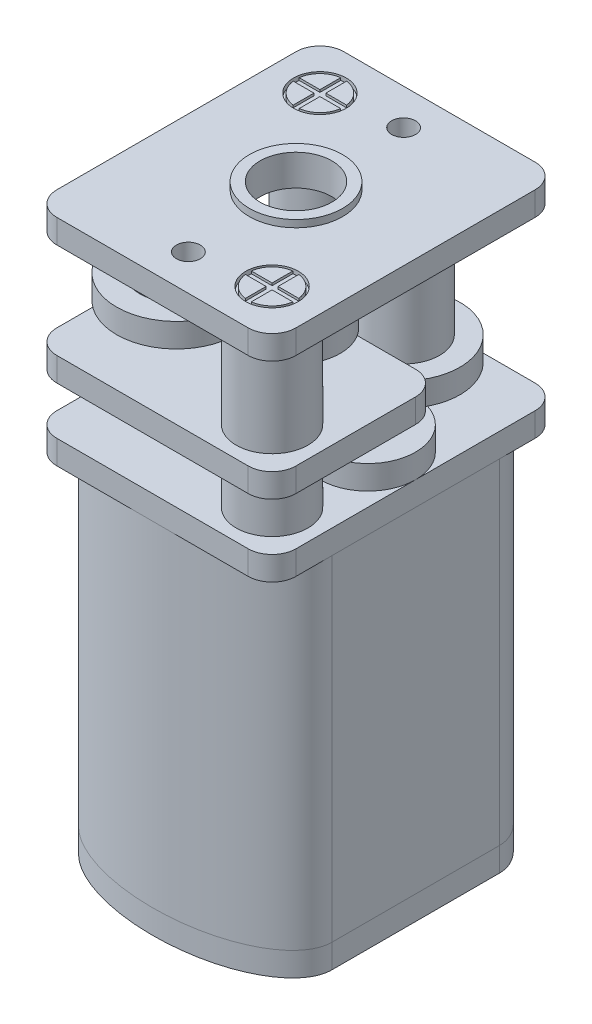
from build123d import *

# Parameters (mm, degrees)
SALIENTE_EXTRUIR1_DEPTH       = 1
CROQUIS2_R                    = 2.5
SALIENTE_EXTRUIR2_DEPTH       = 1
CROQUIS3_R                    = 1
CORTAR_EXTRUIR1_DEPTH         = 0.5
CROQUIS4_W                    = 1.5
CROQUIS4_H                    = 0.3
SALIENTE_EXTRUIR3_DEPTH       = 1.5
CROQUIS5_R                    = 0.5
CORTAR_EXTRUIR2_DEPTH         = 0.3
CORTAR_EXTRUIR3_START         = -0.3
CROQUIS6_R                    = 0.5
CORTAR_EXTRUIR3_DEPTH         = 0.3
SALIENTE_EXTRUIR4_DEPTH       = 14
CROQUIS8_W                    = 10
CROQUIS8_H                    = 12
SALIENTE_EXTRUIR5_DEPTH       = 1
CROQUIS23_R                   = 1
SALIENTE_EXTRUIR13_DEPTH      = 1
CROQUIS25_R                   = 2
SALIENTE_EXTRUIR18_DEPTH      = 1
CROQUIS26_R                   = 1
SALIENTE_EXTRUIR19_DEPTH      = 1
CROQUIS27_R                   = 2.354101966
SALIENTE_EXTRUIR21_DEPTH      = 1
CROQUIS29_R                   = 1.5
SALIENTE_EXTRUIR22_DEPTH      = 3
REDONDEO1_R                   = 1
REDONDEO2_R                   = 1
REDONDEO3_R                   = 1
REDONDEO4_R                   = 1
CROQUIS9_R                    = 1.5
SALIENTE_EXTRUIR6_DEPTH       = 2
CROQUIS10_W                   = 10
CROQUIS10_H                   = 12
SALIENTE_EXTRUIR7_DEPTH       = 1
CROQUIS11_R                   = 1.5
SALIENTE_EXTRUIR8_DEPTH       = 4
CROQUIS12_W                   = 5
CROQUIS12_H                   = 5
CORTAR_EXTRUIR4_DEPTH         = 1
CROQUIS30_R                   = 1.854101966
SALIENTE_EXTRUIR24_DEPTH      = 1
CROQUIS31_R                   = 1
SALIENTE_EXTRUIR26_DEPTH      = 1
CROQUIS32_R                   = 2.5
SALIENTE_EXTRUIR27_DEPTH      = 1
CROQUIS33_R                   = 1.535533906
SALIENTE_EXTRUIR28_DEPTH      = 2
SALIENTE_EXTRUIR29_DEPTH      = 2
SALIENTE_EXTRUIR29_DEPTH_BACK = 5
CROQUIS34_R                   = 0.2
CROQUIS35_R                   = 0.2
SALIENTE_EXTRUIR30_DEPTH      = 4
CROQUIS36_R                   = 0.2
SALIENTE_EXTRUIR31_DEPTH      = 2
REDONDEO5_R                   = 1
REDONDEO6_R                   = 1
REDONDEO7_R                   = 1
REDONDEO8_R                   = 1
REDONDEO9_R                   = 1
CROQUIS13_W                   = 10
CROQUIS13_H                   = 12
SALIENTE_EXTRUIR9_DEPTH       = 1
CROQUIS14_R                   = 1.95
CROQUIS14_R_2                 = 1.5
SALIENTE_EXTRUIR10_DEPTH      = 0.3
CROQUIS15_R                   = 0.5
CORTAR_EXTRUIR5_DEPTH         = 1
CROQUIS16_R                   = 1.1
CORTAR_EXTRUIR6_DEPTH         = 0.2
CROQUIS17_R                   = 1
SALIENTE_EXTRUIR11_DEPTH      = 0.2
CROQUIS18_R                   = 1
SALIENTE_EXTRUIR12_DEPTH      = 0.2
CORTAR_EXTRUIR7_DEPTH         = 0.1
CORTAR_EXTRUIR8_DEPTH         = 0.1
REDONDEO10_R                  = 1
REDONDEO11_R                  = 1
REDONDEO12_R                  = 1
REDONDEO13_R                  = 1
REDONDEO14_R                  = 1
CROQUIS22_R                   = 1.5
CORTAR_EXTRUIR9_DEPTH         = 1


with BuildPart() as part:
    # Croquis1 → Saliente-Extruir1 (new body)
    with BuildSketch(Plane(origin=(0, 0, 0), x_dir=(1, 0, 0), z_dir=(0, 1, 0))):
        with BuildLine():
            Line((5, 3.5), (5, -3.5))
            add(Edge.make_bspline(
                [(-5, -3.5), (-5, -6), (0, -6), (5, -6), (5, -3.5)],
                knots=[3.141592654, 3.141592654, 3.141592654, 4.71238898, 4.71238898, 6.283185307, 6.283185307, 6.283185307], degree=2, weights=[1, 0.707106781, 1, 0.707106781, 1]))
            Line((-5, -3.5), (-5, 3.5))
            add(Edge.make_bspline(
                [(5, 3.5), (5, 6), (0, 6), (-5, 6), (-5, 3.5)],
                knots=[3.141592654, 3.141592654, 3.141592654, 4.71238898, 4.71238898, 6.283185307, 6.283185307, 6.283185307], degree=2, weights=[1, 0.707106781, 1, 0.707106781, 1]))
        make_face()
    extrude(amount=SALIENTE_EXTRUIR1_DEPTH)

    # Croquis2 → Saliente-Extruir2 (add)
    with BuildSketch(Plane.XZ):
        with Locations(Location((0, 0, 0), (0, 0, 90))):
            Circle(CROQUIS2_R)
    extrude(amount=SALIENTE_EXTRUIR2_DEPTH)

    # Croquis3 → Cortar-Extruir1 (cut)
    with BuildSketch(Plane.XZ.offset(1)):
        with Locations(Location((0, 0, 0), (0, 0, 270))):
            Circle(CROQUIS3_R)
    extrude(amount=-CORTAR_EXTRUIR1_DEPTH, mode=Mode.SUBTRACT)

    # Croquis4 → Saliente-Extruir3 (add)
    with BuildSketch(Plane.XZ):
        with Locations((0, 3.65)):
            Rectangle(CROQUIS4_W, CROQUIS4_H)
        with Locations((0, -3.65)):
            Rectangle(CROQUIS4_W, CROQUIS4_H)
    extrude(amount=SALIENTE_EXTRUIR3_DEPTH)

    # Croquis5 → Cortar-Extruir2 (cut)
    with BuildSketch(Plane(origin=(0, 0, -3.8), x_dir=(-1, 0, 0), z_dir=(0, 0, -1))):
        with Locations((0, -0.75)):
            Circle(CROQUIS5_R)
    extrude(amount=-CORTAR_EXTRUIR2_DEPTH, mode=Mode.SUBTRACT)

    # Croquis6 → Cortar-Extruir3 (cut)
    with BuildSketch(Plane.XY.offset(3.8).offset(CORTAR_EXTRUIR3_START)):
        with Locations(Location((0, -0.75, 0), (0, 0, 180))):
            Circle(CROQUIS6_R)
    extrude(amount=CORTAR_EXTRUIR3_DEPTH, mode=Mode.SUBTRACT)


with BuildPart() as body_2:
    # Croquis7 → Saliente-Extruir4 (new body)
    with BuildSketch(Plane(origin=(0, 1, 0), x_dir=(1, 0, 0), z_dir=(0, 1, 0))):
        with BuildLine():
            Line((-5, 3.5), (-5, -3.5))
            add(Edge.make_bspline(
                [(-5, -3.5), (-5, -6), (0, -6), (5, -6), (5, -3.5)],
                knots=[0, 0, 0, 1.570796327, 1.570796327, 3.141592654, 3.141592654, 3.141592654], degree=2, weights=[1, 0.707106781, 1, 0.707106781, 1]))
            Line((5, -3.5), (5, 3.5))
            add(Edge.make_bspline(
                [(5, 3.5), (5, 6), (0, 6), (-5, 6), (-5, 3.5)],
                knots=[3.141592654, 3.141592654, 3.141592654, 4.71238898, 4.71238898, 6.283185307, 6.283185307, 6.283185307], degree=2, weights=[1, 0.707106781, 1, 0.707106781, 1]))
        make_face()
    extrude(amount=SALIENTE_EXTRUIR4_DEPTH)


with BuildPart() as body_3:
    # Croquis8 → Saliente-Extruir5 (new body)
    with BuildSketch(Plane(origin=(0, 15, 0), x_dir=(1, 0, 0), z_dir=(0, 1, 0))):
        Rectangle(CROQUIS8_W, CROQUIS8_H)
    extrude(amount=SALIENTE_EXTRUIR5_DEPTH)

    # Redondeo1
    redondeo1_edges = [body_3.edges().sort_by_distance(p)[0] for p in [
        (-5, 15.5, -6),
    ]]
    fillet(redondeo1_edges, radius=REDONDEO1_R)

    # Redondeo2
    redondeo2_edges = [body_3.edges().sort_by_distance(p)[0] for p in [
        (5, 15.5, -6),
    ]]
    fillet(redondeo2_edges, radius=REDONDEO2_R)

    # Redondeo3
    redondeo3_edges = [body_3.edges().sort_by_distance(p)[0] for p in [
        (5, 15.5, 6),
    ]]
    fillet(redondeo3_edges, radius=REDONDEO3_R)

    # Redondeo4
    redondeo4_edges = [body_3.edges().sort_by_distance(p)[0] for p in [
        (-5, 15.5, 6),
    ]]
    fillet(redondeo4_edges, radius=REDONDEO4_R)

    # Croquis9 → Saliente-Extruir6 (add)
    with BuildSketch(Plane(origin=(0, 16, 0), x_dir=(1, 0, 0), z_dir=(0, 1, 0))):
        with Locations(Location((-3, 4, 0), (0, 0, 90))):
            Circle(CROQUIS9_R)
        with Locations(Location((3, -4, 0), (0, 0, 90))):
            Circle(CROQUIS9_R)
    extrude(amount=SALIENTE_EXTRUIR6_DEPTH)

    # Croquis10 → Saliente-Extruir7 (add)
    with BuildSketch(Plane(origin=(0, 18, 0), x_dir=(1, 0, 0), z_dir=(0, 1, 0))):
        Rectangle(CROQUIS10_W, CROQUIS10_H)
    extrude(amount=SALIENTE_EXTRUIR7_DEPTH)

    # Croquis11 → Saliente-Extruir8 (add)
    with BuildSketch(Plane(origin=(0, 19, 0), x_dir=(1, 0, 0), z_dir=(0, 1, 0))):
        with Locations(Location((3, -4, 0), (0, 0, 90))):
            Circle(CROQUIS11_R)
        with Locations(Location((-3, 4, 0), (0, 0, 90))):
            Circle(CROQUIS11_R)
    extrude(amount=SALIENTE_EXTRUIR8_DEPTH)

    # Croquis12 → Cortar-Extruir4 (cut)
    with BuildSketch(Plane(origin=(0, 19, 0), x_dir=(1, 0, 0), z_dir=(0, 1, 0))):
        with Locations((2.5, 3.5)):
            Rectangle(CROQUIS12_W, CROQUIS12_H)
    extrude(amount=-CORTAR_EXTRUIR4_DEPTH, mode=Mode.SUBTRACT)

    # Redondeo5
    redondeo5_edges = [body_3.edges().sort_by_distance(p)[0] for p in [
        (5, 18.5, -1),
    ]]
    fillet(redondeo5_edges, radius=REDONDEO5_R)

    # Redondeo6
    redondeo6_edges = [body_3.edges().sort_by_distance(p)[0] for p in [
        (0, 18.5, -6),
    ]]
    fillet(redondeo6_edges, radius=REDONDEO6_R)

    # Redondeo7
    redondeo7_edges = [body_3.edges().sort_by_distance(p)[0] for p in [
        (-5, 18.5, -6),
    ]]
    fillet(redondeo7_edges, radius=REDONDEO7_R)

    # Redondeo8
    redondeo8_edges = [body_3.edges().sort_by_distance(p)[0] for p in [
        (-5, 18.5, 6),
    ]]
    fillet(redondeo8_edges, radius=REDONDEO8_R)

    # Redondeo9
    redondeo9_edges = [body_3.edges().sort_by_distance(p)[0] for p in [
        (5, 18.5, 6),
    ]]
    fillet(redondeo9_edges, radius=REDONDEO9_R)

    # Croquis13 → Saliente-Extruir9 (add)
    with BuildSketch(Plane(origin=(0, 23, 0), x_dir=(1, 0, 0), z_dir=(0, 1, 0))):
        Rectangle(CROQUIS13_W, CROQUIS13_H)
    extrude(amount=SALIENTE_EXTRUIR9_DEPTH)

    # Croquis14 → Saliente-Extruir10 (add)
    with BuildSketch(Plane(origin=(0, 24, 0), x_dir=(1, 0, 0), z_dir=(0, 1, 0))):
        with Locations(Location((0, 0, 0), (0, 0, 90))):
            Circle(CROQUIS14_R)
        with Locations(Location((0, 0, 0), (0, 0, 270))):
            Circle(CROQUIS14_R_2, mode=Mode.SUBTRACT)
    extrude(amount=SALIENTE_EXTRUIR10_DEPTH)

    # Croquis15 → Cortar-Extruir5 (cut)
    with BuildSketch(Plane(origin=(0, 24, 0), x_dir=(1, 0, 0), z_dir=(0, 1, 0))):
        with Locations(Location((0, 4.5, 0), (0, 0, 270))):
            Circle(CROQUIS15_R)
        with Locations(Location((0, -4.5, 0), (0, 0, 90))):
            Circle(CROQUIS15_R)
    extrude(amount=-CORTAR_EXTRUIR5_DEPTH, mode=Mode.SUBTRACT)

    # Croquis16 → Cortar-Extruir6 (cut)
    with BuildSketch(Plane(origin=(0, 24, 0), x_dir=(1, 0, 0), z_dir=(0, 1, 0))):
        with Locations(Location((3, -4, 0), (0, 0, 270))):
            Circle(CROQUIS16_R)
        with Locations(Location((-3, 4, 0), (0, 0, 270))):
            Circle(CROQUIS16_R)
    extrude(amount=-CORTAR_EXTRUIR6_DEPTH, mode=Mode.SUBTRACT)

    # Redondeo10
    redondeo10_edges = [body_3.edges().sort_by_distance(p)[0] for p in [
        (-5, 23.5, 6),
    ]]
    fillet(redondeo10_edges, radius=REDONDEO10_R)

    # Redondeo11
    redondeo11_edges = [body_3.edges().sort_by_distance(p)[0] for p in [
        (5, 23.5, 6),
    ]]
    fillet(redondeo11_edges, radius=REDONDEO11_R)

    # Redondeo12
    redondeo12_edges = [body_3.edges().sort_by_distance(p)[0] for p in [
        (5, 23.5, -6),
    ]]
    fillet(redondeo12_edges, radius=REDONDEO12_R)

    # Redondeo13
    redondeo13_edges = [body_3.edges().sort_by_distance(p)[0] for p in [
        (-5, 23.5, -6),
    ]]
    fillet(redondeo13_edges, radius=REDONDEO13_R)

    # Redondeo14
    redondeo14_edges = [body_3.edges().sort_by_distance(p)[0] for p in [
        (0, 18.5, -1),
    ]]
    fillet(redondeo14_edges, radius=REDONDEO14_R)

    # Croquis22 → Cortar-Extruir9 (cut)
    with BuildSketch(Plane(origin=(0, 24, 0), x_dir=(1, 0, 0), z_dir=(0, 1, 0))):
        with Locations(Location((0, 0, 0), (0, 0, 270))):
            Circle(CROQUIS22_R)
    extrude(amount=-CORTAR_EXTRUIR9_DEPTH, mode=Mode.SUBTRACT)


with BuildPart() as body_4:
    # Croquis23 → Saliente-Extruir13 (new body)
    with BuildSketch(Plane(origin=(0, 16, 0), x_dir=(1, 0, 0), z_dir=(0, 1, 0))):
        with Locations(Location((0, 0, 0), (0, 0, 270))):
            Circle(CROQUIS23_R)
    extrude(amount=SALIENTE_EXTRUIR13_DEPTH)


with BuildPart() as body_5:
    # Croquis25 → Saliente-Extruir18 (new body)
    with BuildSketch(Plane(origin=(0, 16, 0), x_dir=(1, 0, 0), z_dir=(0, 1, 0))):
        with Locations(Location((3, 0, 0), (0, 0, 270))):
            Circle(CROQUIS25_R)
    extrude(amount=SALIENTE_EXTRUIR18_DEPTH)

    # Croquis26 → Saliente-Extruir19 (add)
    with BuildSketch(Plane(origin=(0, 17, 0), x_dir=(1, 0, 0), z_dir=(0, 1, 0))):
        with Locations(Location((3, 0, 0), (0, 0, 270))):
            Circle(CROQUIS26_R)
    extrude(amount=SALIENTE_EXTRUIR19_DEPTH)


with BuildPart() as body_6:
    # Croquis27 → Saliente-Extruir21 (new body)
    with BuildSketch(Plane(origin=(0, 17, 0), x_dir=(1, 0, 0), z_dir=(0, 1, 0))):
        with Locations(Location((1.5, 3, 0), (0, 0, 270))):
            Circle(CROQUIS27_R)
    extrude(amount=SALIENTE_EXTRUIR21_DEPTH)

    # Croquis29 → Saliente-Extruir22 (add)
    with BuildSketch(Plane(origin=(0, 18, 0), x_dir=(1, 0, 0), z_dir=(0, 1, 0))):
        with Locations(Location((1.5, 3, 0), (0, 0, 270))):
            Circle(CROQUIS29_R)
    extrude(amount=SALIENTE_EXTRUIR22_DEPTH)


with BuildPart() as body_7:
    # Croquis30 → Saliente-Extruir24 (new body)
    with BuildSketch(Plane(origin=(0, 19, 0), x_dir=(1, 0, 0), z_dir=(0, 1, 0))):
        with Locations(Location((0, 0, 0), (0, 0, 270))):
            Circle(CROQUIS30_R)
    extrude(amount=SALIENTE_EXTRUIR24_DEPTH)


with BuildPart() as body_8:
    # Croquis31 → Saliente-Extruir26 (new body)
    with BuildSketch(Plane(origin=(0, 20, 0), x_dir=(1, 0, 0), z_dir=(0, 1, 0))):
        with Locations(Location((0, 0, 0), (0, 0, 270))):
            Circle(CROQUIS31_R)
    extrude(amount=SALIENTE_EXTRUIR26_DEPTH)


with BuildPart() as body_9:
    # Croquis32 → Saliente-Extruir27 (new body)
    with BuildSketch(Plane(origin=(0, 20, 0), x_dir=(1, 0, 0), z_dir=(0, 1, 0))):
        with Locations(Location((-2.5, -2.5, 0), (0, 0, 270))):
            Circle(CROQUIS32_R)
    extrude(amount=SALIENTE_EXTRUIR27_DEPTH)


with BuildPart() as body_10:
    # Croquis33 → Saliente-Extruir28 (new body)
    with BuildSketch(Plane(origin=(0, 21, 0), x_dir=(1, 0, 0), z_dir=(0, 1, 0))):
        with Locations(Location((-2.5, -2.5, 0), (0, 0, 270))):
            Circle(CROQUIS33_R)
    extrude(amount=SALIENTE_EXTRUIR28_DEPTH)


with BuildPart() as body_11:
    # Croquis34 → Saliente-Extruir29 (new, two sides: drawn at the far end of the back side and taken through both)
    with BuildSketch(Plane(origin=(0, 21, 0), x_dir=(1, 0, 0), z_dir=(0, 1, 0)).offset(-SALIENTE_EXTRUIR29_DEPTH_BACK)):
        with Locations(Location((1.5, 3, 0), (0, 0, 270))):
            Circle(CROQUIS34_R)
    extrude(amount=SALIENTE_EXTRUIR29_DEPTH + SALIENTE_EXTRUIR29_DEPTH_BACK)


with BuildPart() as body_12:
    # Croquis35 → Saliente-Extruir30 (new body)
    with BuildSketch(Plane(origin=(0, 23, 0), x_dir=(1, 0, 0), z_dir=(0, 1, 0))):
        with Locations(Location((-2.5, -2.5, 0), (0, 0, 270))):
            Circle(CROQUIS35_R)
    extrude(amount=-SALIENTE_EXTRUIR30_DEPTH)


with BuildPart() as body_13:
    # Croquis36 → Saliente-Extruir31 (new body)
    with BuildSketch(Plane(origin=(0, 21, 0), x_dir=(1, 0, 0), z_dir=(0, 1, 0))):
        with Locations(Location((0, 0, 0), (0, 0, 270))):
            Circle(CROQUIS36_R)
    extrude(amount=SALIENTE_EXTRUIR31_DEPTH)


with BuildPart() as body_14:
    # Croquis17 → Saliente-Extruir11 (new body)
    with BuildSketch(Plane(origin=(0, 23.8, 0), x_dir=(1, 0, 0), z_dir=(0, 1, 0))):
        with Locations(Location((-3, 4, 0), (0, 0, 270))):
            Circle(CROQUIS17_R)
    extrude(amount=SALIENTE_EXTRUIR11_DEPTH)

    # Croquis19 → Cortar-Extruir7 (cut)
    with BuildSketch(Plane(origin=(0, 24, 0), x_dir=(1, 0, 0), z_dir=(0, 1, 0))):
        with BuildLine():
            Line((-3.125, 4.125), (-3.125, 4.992156742))
            ThreePointArc((-3.125, 4.992156742), (-3, 5), (-2.875, 4.992156742))
            Line((-2.875, 4.992156742), (-2.875, 4.125))
            Line((-2.875, 4.125), (-2.007843258, 4.125))
            ThreePointArc((-2.007843258, 4.125), (-2, 4), (-2.007843258, 3.875))
            Line((-2.007843258, 3.875), (-2.875, 3.875))
            Line((-2.875, 3.875), (-2.875, 3.007843258))
            ThreePointArc((-2.875, 3.007843258), (-3, 3), (-3.125, 3.007843258))
            Line((-3.125, 3.007843258), (-3.125, 3.875))
            Line((-3.125, 3.875), (-3.992156742, 3.875))
            ThreePointArc((-3.992156742, 3.875), (-4, 4), (-3.992156742, 4.125))
            Line((-3.992156742, 4.125), (-3.125, 4.125))
        make_face()
    extrude(amount=-CORTAR_EXTRUIR7_DEPTH, mode=Mode.SUBTRACT)


with BuildPart() as body_15:
    # Croquis18 → Saliente-Extruir12 (new body)
    with BuildSketch(Plane(origin=(0, 23.8, 0), x_dir=(1, 0, 0), z_dir=(0, 1, 0))):
        with Locations(Location((3, -4, 0), (0, 0, 270))):
            Circle(CROQUIS18_R)
    extrude(amount=SALIENTE_EXTRUIR12_DEPTH)

    # Croquis21 → Cortar-Extruir8 (cut)
    with BuildSketch(Plane(origin=(0, 24, 0), x_dir=(1, 0, 0), z_dir=(0, 1, 0))):
        with BuildLine():
            Line((2.875, -3.875), (2.875, -3.007843258))
            ThreePointArc((2.875, -3.007843258), (3, -3), (3.125, -3.007843258))
            Line((3.125, -3.007843258), (3.125, -3.875))
            Line((3.125, -3.875), (3.992156742, -3.875))
            ThreePointArc((3.992156742, -3.875), (4, -4), (3.992156742, -4.125))
            Line((3.992156742, -4.125), (3.125, -4.125))
            Line((3.125, -4.125), (3.125, -4.992156742))
            ThreePointArc((3.125, -4.992156742), (3, -5), (2.875, -4.992156742))
            Line((2.875, -4.992156742), (2.875, -4.125))
            Line((2.875, -4.125), (2.007843258, -4.125))
            ThreePointArc((2.007843258, -4.125), (2, -4), (2.007843258, -3.875))
            Line((2.007843258, -3.875), (2.875, -3.875))
        make_face()
    extrude(amount=-CORTAR_EXTRUIR8_DEPTH, mode=Mode.SUBTRACT)


solid = Compound([part.part, body_2.part, body_3.part, body_4.part, body_5.part, body_6.part, body_7.part, body_8.part, body_9.part, body_10.part, body_11.part, body_12.part, body_13.part, body_14.part, body_15.part])
